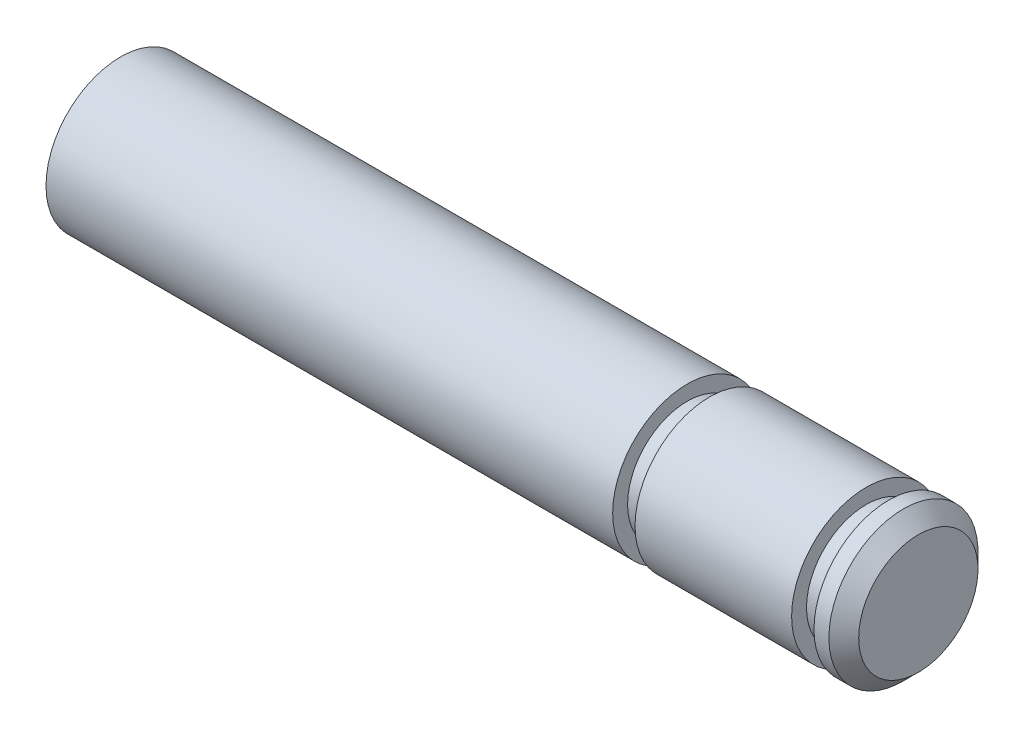
from build123d import *

# Parameters (mm, degrees)
CHAMFER1_SIZE = 1


with BuildPart() as part:
    # Sketch1 → Revolve1 (revolve)
    with BuildSketch(Plane.XY, mode=Mode.PRIVATE) as revolve1_sk:
        Polygon((0, 0), (0, 5), (38, 5), (38, 4), (39.5, 4), (39.5, 5), (50, 5), (50, 4), (51.5, 4), (51.5, 5), (53.5, 5), (53.5, 0), align=None)
    revolve(revolve1_sk.sketch.rotate(Axis((-16.67807852, 0, 0), (1, 0, 0)), 90), axis=Axis((-16.67807852, 0, 0), (1, 0, 0)))

    # Chamfer1
    chamfer1_edges = [part.edges().sort_by_distance(p)[0] for p in [
        (53.5, 0, -5),
    ]]
    chamfer(chamfer1_edges, length=CHAMFER1_SIZE)


solid = part.part
